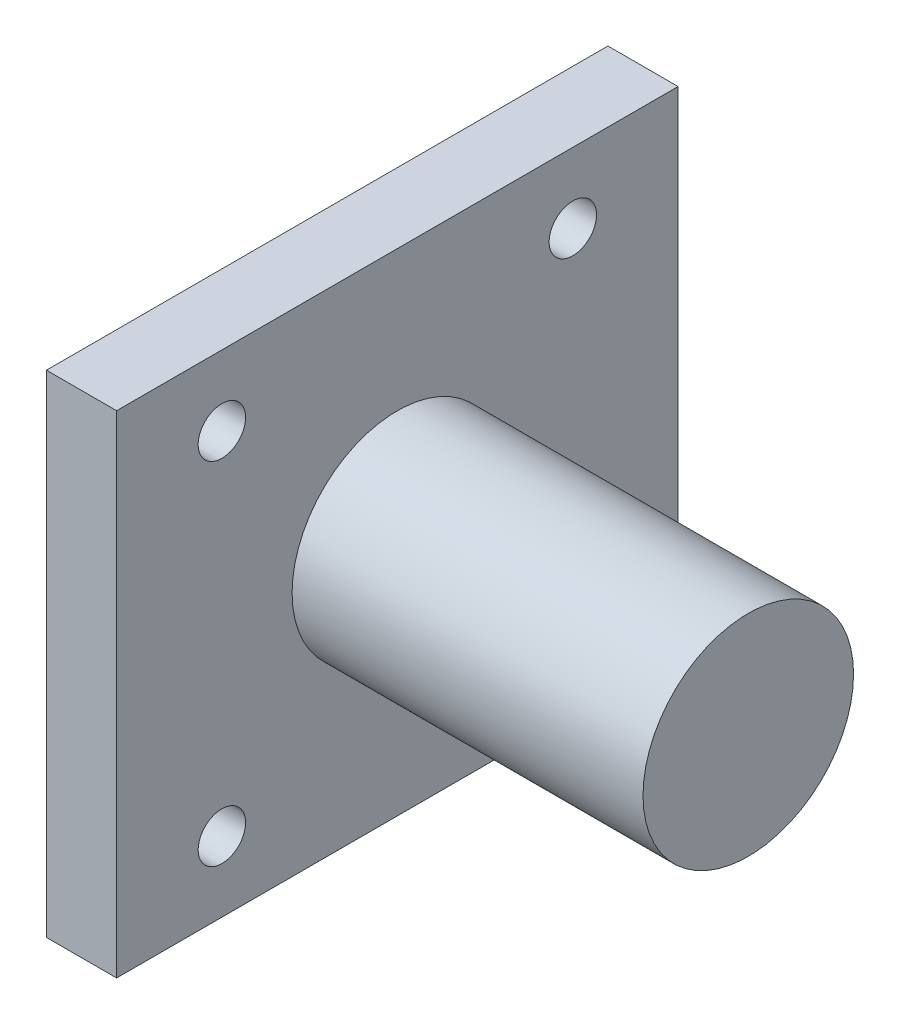
from build123d import *

# Parameters (mm, degrees)
SKETCH1_W                = 80
SKETCH1_H                = 70
BOSS_EXTRUDE1_DEPTH      = 10
BOSS_EXTRUDE2_DEPTH      = 50
BOSS_EXTRUDE2_DEPTH_BACK = 25
SKETCH2_R                = 15
LPATTERN1_COUNT          = 2
LPATTERN1_PITCH          = 50
LPATTERN1_COUNT_DIR2     = 2
LPATTERN1_PITCH_DIR2     = 50


with BuildPart() as part:
    # Sketch1 → Boss-Extrude1 (new body)
    with BuildSketch(Plane(origin=(0, 0, 0), x_dir=(0, 0, -1), z_dir=(1, 0, 0))):
        Rectangle(SKETCH1_W, SKETCH1_H)
    extrude(amount=BOSS_EXTRUDE1_DEPTH)

    # Sketch2 → Boss-Extrude2 (add, two sides: drawn at the far end of the back side and taken through both)
    with BuildSketch(Plane(origin=(10, 0, 0), x_dir=(0, 0, -1), z_dir=(1, 0, 0)).offset(-BOSS_EXTRUDE2_DEPTH_BACK)):
        Circle(SKETCH2_R)
    extrude(amount=BOSS_EXTRUDE2_DEPTH + BOSS_EXTRUDE2_DEPTH_BACK)

    # Sketch4 → 1/4 Clearance Hole1 (revolve, cut)
    with BuildSketch(Plane(origin=(10, 25, 25), x_dir=(0, 0, -1), z_dir=(0, 1, 0))):
        Polygon((0, 0), (0, 31.239827343), (3.3782, 29.21), (3.3782, 0), align=None)
    f_1_4_clearance_hole1 = revolve(axis=Axis((16.35, 25, 25), (-1, 0, 0)), mode=Mode.SUBTRACT)

    # LPattern1: 1_4 Clearance Hole1 2 × 2
    with Locations(*[(0, -j * LPATTERN1_PITCH_DIR2, -i * LPATTERN1_PITCH) for i in range(LPATTERN1_COUNT) for j in range(LPATTERN1_COUNT_DIR2) if (i, j) != (0, 0)]):
        add(f_1_4_clearance_hole1, mode=Mode.SUBTRACT)


solid = part.part
